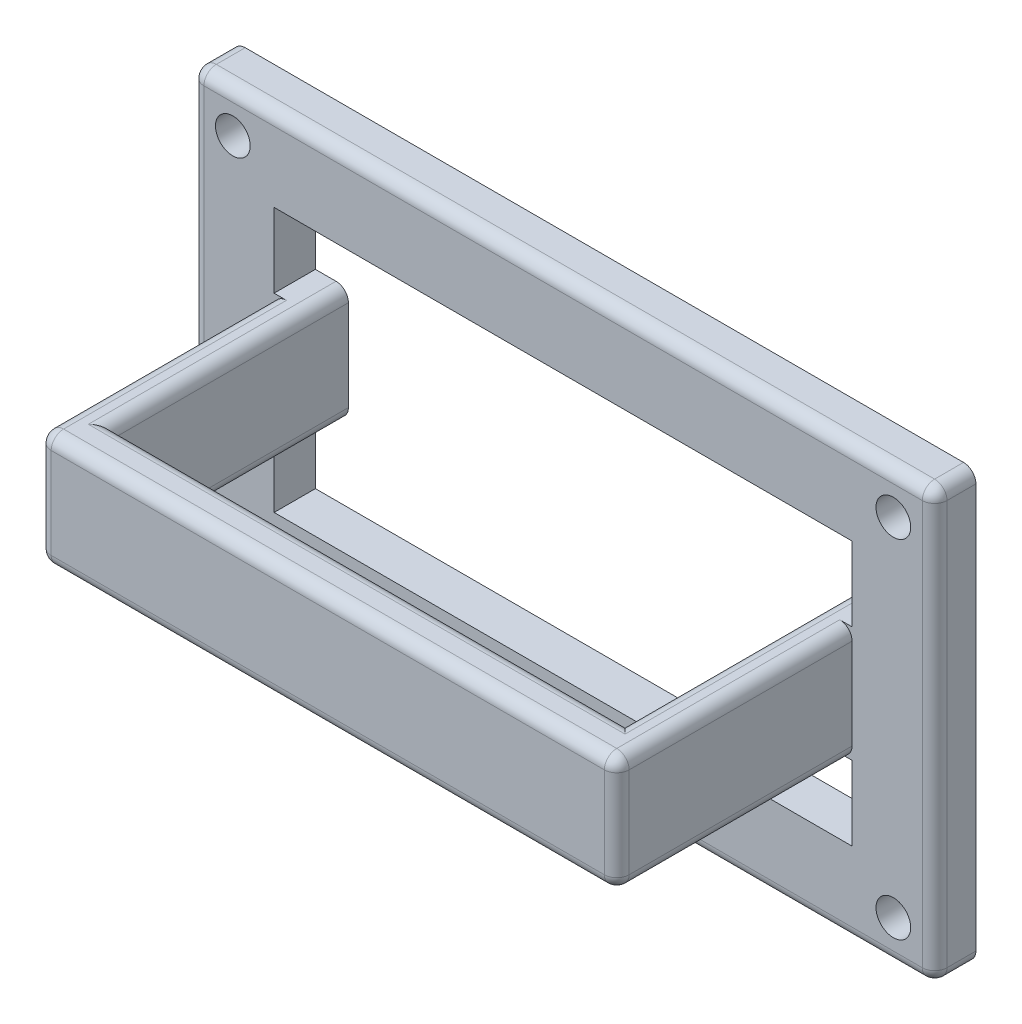
from build123d import *

# Parameters (mm, degrees)
SKETCH2_W                 = 52
SKETCH2_H                 = 90
BOSS_EXTRUDE1_DEPTH       = 5
BOSS_EXTRUDE2_DEPTH       = 14
M5X0_8_TAPPED_HOLE1_D     = 4.2
M5X0_8_TAPPED_HOLE1_DEPTH = 7.5
M5X0_8_TAPPED_HOLE1_TIP   = 1.2618073
FILLET1_R                 = 1.5


with BuildPart() as part:
    # Sketch2 → Boss-Extrude1 (new body)
    with BuildSketch(Plane(origin=(0, 0, 0), x_dir=(0, 1, 0), z_dir=(0, 0, 1))):
        Rectangle(SKETCH2_W, SKETCH2_H)
        Polygon((-16, 35), (-7, 35), (-7, 31), (7, 31), (7, 35), (16, 35), (16, -35), (7, -35), (7, -31), (-7, -31), (-7, -35), (-16, -35), align=None, mode=Mode.SUBTRACT)
    extrude(amount=BOSS_EXTRUDE1_DEPTH)

    # Sketch4 → Boss-Extrude2 (add)
    with BuildSketch(Plane.XZ.offset(7)):
        Polygon((-35, 5), (-35, 33.5), (35, 33.5), (35, 5), (31, 5), (31, 28.5), (-31, 28.5), (-31, 5), align=None)
    extrude(amount=-BOSS_EXTRUDE2_DEPTH)

    # M5x0.8 Tapped Hole1
    with Locations(Plane.XY.offset(5)):
        with Locations((-40, 21), (40, 21), (-40, -21), (40, -21)):
            Hole(M5X0_8_TAPPED_HOLE1_D / 2, depth=M5X0_8_TAPPED_HOLE1_DEPTH)
            with Locations((0, 0, -(M5X0_8_TAPPED_HOLE1_DEPTH + M5X0_8_TAPPED_HOLE1_TIP / 2))):  # 118° drill point
                Cone(0, M5X0_8_TAPPED_HOLE1_D / 2, M5X0_8_TAPPED_HOLE1_TIP, mode=Mode.SUBTRACT)

    # Fillet1
    fillet1_edges = [part.edges().sort_by_distance(p)[0] for p in [
        (0, 26, 5),
        (-45, 0, 5),
        (31, -7, 14.25),
        (31, 7, 14.25),
        (-31, 7, 14.25),
        (-31, -7, 14.25),
        (0, -26, 5),
        (-35, 7, 19.25),
        (0, 7, 33.5),
        (-35, 0, 33.5),
        (35, 7, 19.25),
        (35, 0, 33.5),
        (0, 7, 28.5),
        (0, -7, 28.5),
        (35, -7, 19.25),
        (0, -7, 33.5),
        (-35, -7, 19.25),
        (-45, -26, 2.5),
        (-45, 26, 2.5),
        (45, 26, 2.5),
        (45, -26, 2.5),
        (45, 0, 5),
    ]]
    fillet(fillet1_edges, radius=FILLET1_R)


solid = part.part
